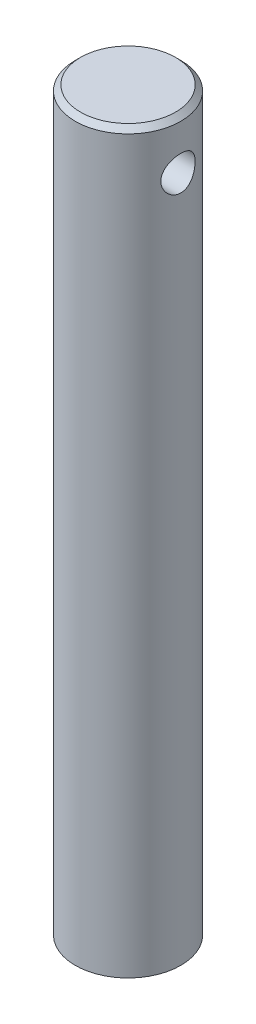
from build123d import *

# Parameters (mm, degrees)
SKETCH_1_W              = 10
SKETCH_1_H              = 139.5
HOLE_WIZARD_6_5_6_5_1_D = 6.5
CHAMFER_1_SIZE          = 1


with BuildPart() as part:
    # 草图1 → 旋转1 (revolve)
    with BuildSketch(Plane.XY):
        with Locations((5, -60.25)):
            Rectangle(SKETCH_1_W, SKETCH_1_H)
    revolve(axis=Axis((0, 9.5, 0), (0, -1, 0)))

    # Ø6.5 (6.5) 直径孔1 (through all)
    with Locations(Plane(origin=(-10, 0, 0), x_dir=(0, 0, -1), z_dir=(-1, 0, 0))):
        with Locations((0, 0)):
            Hole(HOLE_WIZARD_6_5_6_5_1_D / 2)

    # 倒角1
    chamfer_1_edges = [part.edges().sort_by_distance(p)[0] for p in [
        (-10, 9.5, 0),
    ]]
    chamfer(chamfer_1_edges, length=CHAMFER_1_SIZE)


solid = part.part
